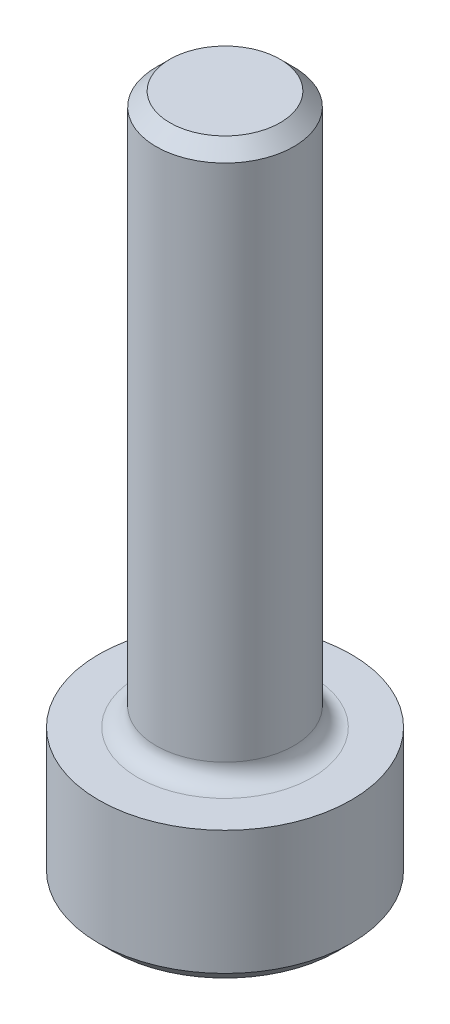
from build123d import *

# Parameters (mm, degrees)
SKETCH2_R           = 1.5
BOSS_EXTRUDE1_DEPTH = 12
SKETCH3_R           = 2.75
BOSS_EXTRUDE2_DEPTH = 3
FILLET1_R           = 0.4
CHAMFER1_SIZE       = 0.3
CUT_EXTRUDE1_DEPTH  = 2.5


with BuildPart() as part:
    # Sketch2 → Boss-Extrude1 (new body)
    with BuildSketch(Plane(origin=(0, 0, 0), x_dir=(1, 0, 0), z_dir=(0, 1, 0))):
        with Locations(Location((0, 0, 0), (0, 0, 270))):
            Circle(SKETCH2_R)
    extrude(amount=BOSS_EXTRUDE1_DEPTH)

    # Sketch3 → Boss-Extrude2 (add)
    with BuildSketch(Plane(origin=(0, 0, 0), x_dir=(1, 0, 0), z_dir=(0, 1, 0))):
        with Locations(Location((0, 0, 0), (0, 0, 270))):
            Circle(SKETCH3_R)
    extrude(amount=-BOSS_EXTRUDE2_DEPTH)

    # Fillet1
    fillet1_edges = [part.edges().sort_by_distance(p)[0] for p in [
        (0, 0, -1.5),
    ]]
    fillet(fillet1_edges, radius=FILLET1_R)

    # Chamfer1
    chamfer1_edges = [part.edges().sort_by_distance(p)[0] for p in [
        (0, 12, -1.5),
        (0, -3, -2.75),
    ]]
    chamfer(chamfer1_edges, length=CHAMFER1_SIZE)

    # Sketch4 → Cut-Extrude1 (cut)
    with BuildSketch(Plane.XZ.offset(3)):
        Polygon((0, 1.443375673), (-1.25, 0.721687836), (-1.25, -0.721687836), (0, -1.443375673), (1.25, -0.721687836), (1.25, 0.721687836), align=None)
    extrude(amount=-CUT_EXTRUDE1_DEPTH, mode=Mode.SUBTRACT)


solid = part.part
